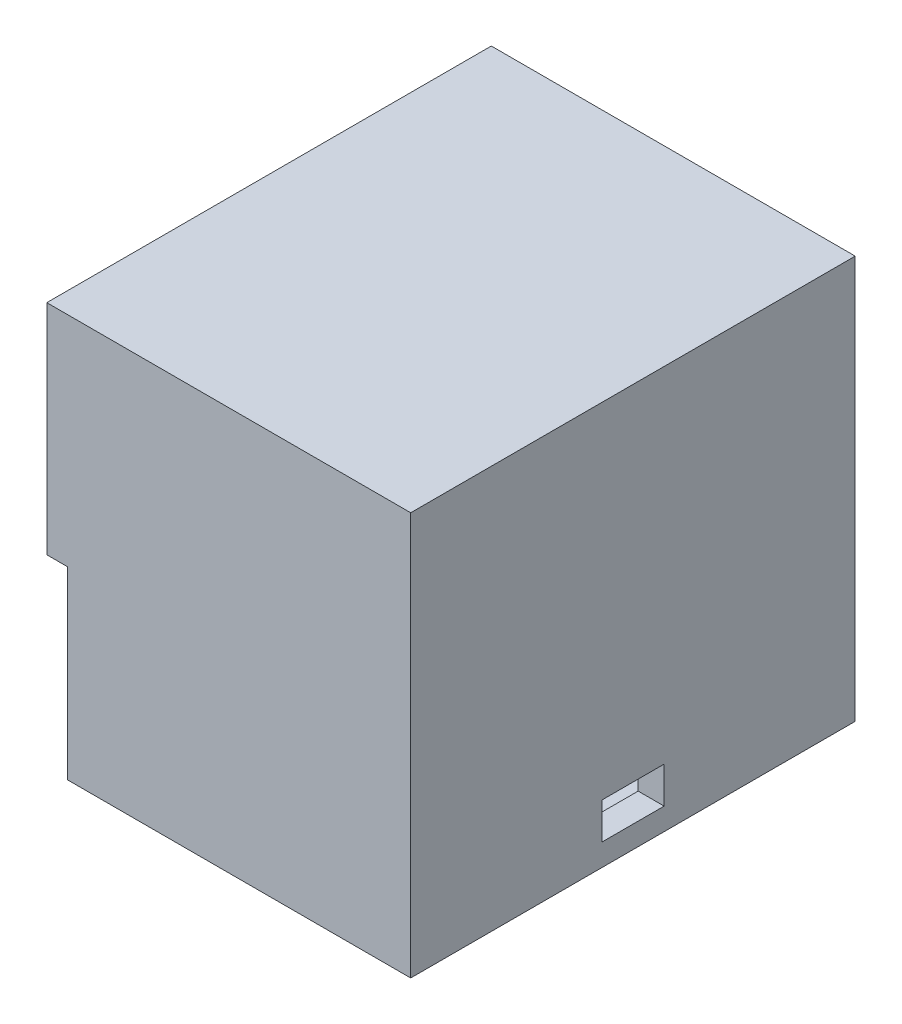
from build123d import *

# Parameters (mm, degrees)
SKETCH1_W             = 70
SKETCH1_H             = 37.5
BOSS_EXTRUDE1_DEPTH   = 85.5
SHELL1_T              = -6
SKETCH4_W             = 58
SKETCH4_H             = 2
BOSS_EXTRUDE2_DEPTH   = 31.5
SKETCH3_W             = 64
SKETCH3_H             = 3
CUT_EXTRUDE2_DEPTH    = 2
BOSS_EXTRUDE3_DEPTH   = 40
SKETCH8_W             = 64
SKETCH8_H             = 79.5
BOSS_EXTRUDE4_DEPTH   = 4.5
SKETCH9_W             = 76.5
SKETCH9_H             = 32.167861311
CUT_EXTRUDE3_DEPTH    = 65
SKETCH14_W            = 85.5
SKETCH14_H            = 35.5
CUT_EXTRUDE4_DEPTH    = 4
M2_TAPPED_HOLE1_D     = 1.6
M2_TAPPED_HOLE1_DEPTH = 4
M2_TAPPED_HOLE1_TIP   = 0.480688495
M2_TAPPED_HOLE2_D     = 1.6
M2_TAPPED_HOLE2_DEPTH = 4
M2_TAPPED_HOLE2_TIP   = 0.480688495
SKETCH17_W            = 12
SKETCH17_H            = 7
CUT_EXTRUDE5_DEPTH    = 10
SKETCH19_W            = 24
SKETCH19_H            = 4
BOSS_EXTRUDE5_DEPTH   = 61
SKETCH20_W            = 5.5
SKETCH20_H            = 9.526840529
BOSS_EXTRUDE7_DEPTH   = 17
SKETCH21_W            = 24
SKETCH21_H            = 4
CUT_EXTRUDE6_DEPTH    = 15.5


with BuildPart() as part:
    # Sketch1 → Boss-Extrude1 (new body)
    with BuildSketch(Plane.XY):
        Rectangle(SKETCH1_W, SKETCH1_H)
    extrude(amount=-BOSS_EXTRUDE1_DEPTH)

    # Shell1
    shell1_openings = [part.faces().sort_by_distance(p)[0] for p in [
        (0, 18.75, -42.75),
    ]]
    offset(amount=SHELL1_T, openings=shell1_openings, kind=Kind.INTERSECTION)

    # Sketch4 → Boss-Extrude2 (add)
    with BuildSketch(Plane(origin=(0, -12.75, 0), x_dir=(1, 0, 0), z_dir=(0, 1, 0))):
        with Locations((0, 78.5)):
            Rectangle(SKETCH4_W, SKETCH4_H)
        with Locations((0, 7)):
            Rectangle(SKETCH4_W, SKETCH4_H)
    extrude(amount=BOSS_EXTRUDE2_DEPTH)

    # Sketch3 → Cut-Extrude2 (cut)
    with BuildSketch(Plane(origin=(0, 18.75, 0), x_dir=(1, 0, 0), z_dir=(0, 1, 0))):
        with Locations((-3, 4.5)):
            Rectangle(SKETCH3_W, SKETCH3_H)
        with Locations((-3, 81)):
            Rectangle(SKETCH3_W, SKETCH3_H)
    extrude(amount=-CUT_EXTRUDE2_DEPTH, mode=Mode.SUBTRACT)

    # Sketch6 → Boss-Extrude3 (add)
    with BuildSketch(Plane(origin=(0, 18.75, 0), x_dir=(1, 0, 0), z_dir=(0, 1, 0))):
        Polygon((29, 79.5), (29, 6), (29, 3), (-35, 3), (-35, 0), (35, 0), (35, 85.5), (-35, 85.5), (-35, 82.5), (29, 82.5), align=None)
    extrude(amount=BOSS_EXTRUDE3_DEPTH)

    # Sketch8 → Boss-Extrude4 (add)
    with BuildSketch(Plane(origin=(0, 58.75, 0), x_dir=(1, 0, 0), z_dir=(0, 1, 0))):
        with Locations((-3, 42.75)):
            Rectangle(SKETCH8_W, SKETCH8_H)
    extrude(amount=-BOSS_EXTRUDE4_DEPTH)

    # Sketch9 → Cut-Extrude3 (cut)
    with BuildSketch(Plane.ZY.offset(35)):
        with Locations((-42.75, -0.972421296)):
            Rectangle(SKETCH9_W, SKETCH9_H)
    extrude(amount=-CUT_EXTRUDE3_DEPTH, mode=Mode.SUBTRACT)

    # Sketch14 → Cut-Extrude4 (cut)
    with BuildSketch(Plane.ZY.offset(35)):
        with Locations((-42.75, -1)):
            Rectangle(SKETCH14_W, SKETCH14_H)
    extrude(amount=-CUT_EXTRUDE4_DEPTH, mode=Mode.SUBTRACT)

    # M2 Tapped Hole1
    with Locations(Plane.ZY.offset(35)):
        with Locations((-2.25, 13.25), (-83.25, -16.5), (-83.25, 13.25), (-2.25, -16.5)):
            Hole(M2_TAPPED_HOLE1_D / 2, depth=M2_TAPPED_HOLE1_DEPTH)
            with Locations((0, 0, -(M2_TAPPED_HOLE1_DEPTH + M2_TAPPED_HOLE1_TIP / 2))):  # 118° drill point
                Cone(0, M2_TAPPED_HOLE1_D / 2, M2_TAPPED_HOLE1_TIP, mode=Mode.SUBTRACT)

    # M2 Tapped Hole2
    with Locations(Plane.ZY.offset(31)):
        with Locations((-2.25, 13.25), (-2.25, -16.5), (-83.25, -16.5), (-83.25, 13.25)):
            Hole(M2_TAPPED_HOLE2_D / 2, depth=M2_TAPPED_HOLE2_DEPTH)
            with Locations((0, 0, -(M2_TAPPED_HOLE2_DEPTH + M2_TAPPED_HOLE2_TIP / 2))):  # 118° drill point
                Cone(0, M2_TAPPED_HOLE2_D / 2, M2_TAPPED_HOLE2_TIP, mode=Mode.SUBTRACT)

    # Sketch17 → Cut-Extrude5 (cut)
    with BuildSketch(Plane(origin=(35, 0, 0), x_dir=(0, 0, -1), z_dir=(1, 0, 0))):
        with Locations((42.75, -10.993248875)):
            Rectangle(SKETCH17_W, SKETCH17_H)
    extrude(amount=-CUT_EXTRUDE5_DEPTH, mode=Mode.SUBTRACT)

    # Sketch19 → Boss-Extrude5 (add)
    with BuildSketch(Plane.ZY.offset(31)):
        with Locations((-69, 0.411509359)):
            Rectangle(SKETCH19_W, SKETCH19_H)
    extrude(amount=-BOSS_EXTRUDE5_DEPTH)

    # Sketch20 → Boss-Extrude7 (add)
    with BuildSketch(Plane.XY.offset(-81)):
        with Locations((16.25, 7.174929624)):
            Rectangle(SKETCH20_W, SKETCH20_H)
        with Locations((-12.75, 7.174929624)):
            Rectangle(SKETCH20_W, SKETCH20_H)
    extrude(amount=BOSS_EXTRUDE7_DEPTH)

    # Sketch21 → Cut-Extrude6 (cut)
    with BuildSketch(Plane.ZY.offset(31)):
        with Locations((-69, 0.411509359)):
            Rectangle(SKETCH21_W, SKETCH21_H)
    extrude(amount=-CUT_EXTRUDE6_DEPTH, mode=Mode.SUBTRACT)


solid = part.part
